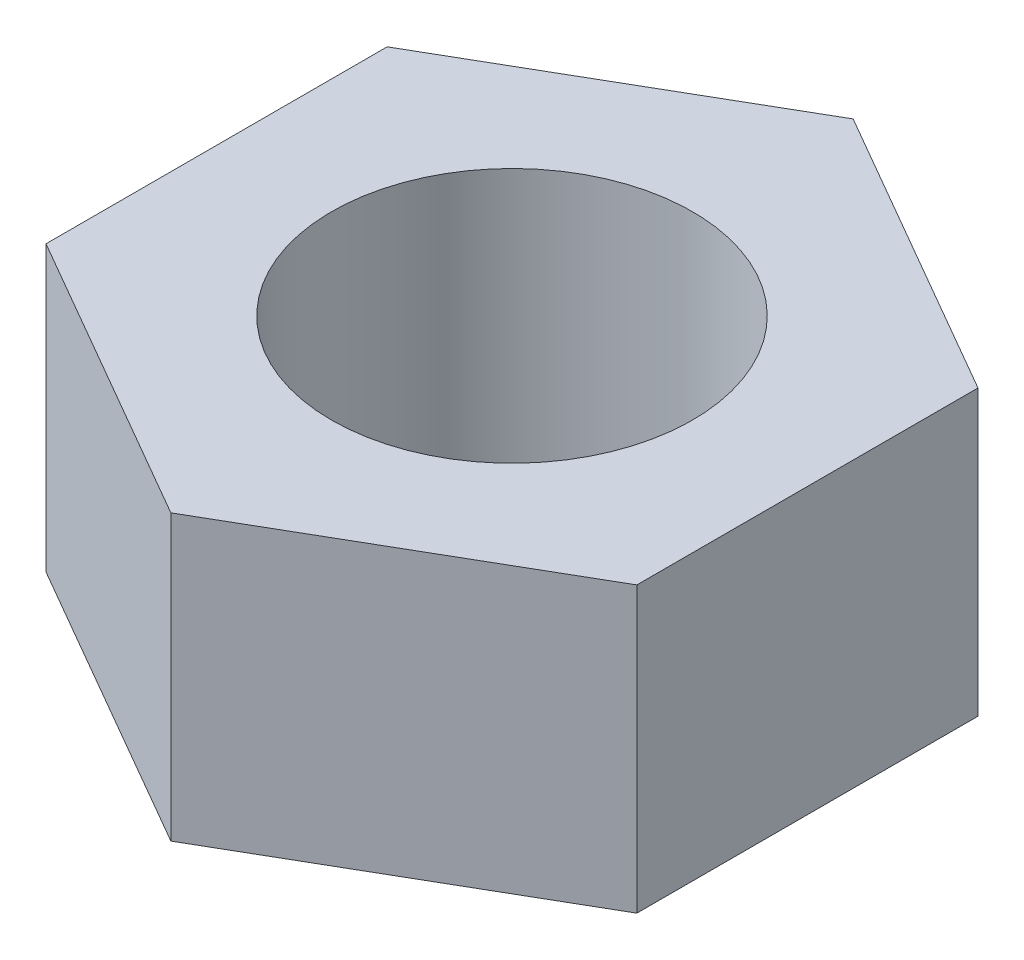
from build123d import *

# Parameters (mm, degrees)
SKETCH1_R           = 3.175
BOSS_EXTRUDE1_DEPTH = 5


with BuildPart() as part:
    # Sketch1 → Boss-Extrude1 (new body)
    with BuildSketch(Plane(origin=(0, 0, 0), x_dir=(1, 0, 0), z_dir=(0, 1, 0))):
        Polygon((0, 6), (-5.196152423, 3), (-5.196152423, -3), (0, -6), (5.196152423, -3), (5.196152423, 3), align=None)
        with Locations(Location((0, 0, 0), (0, 0, 270))):
            Circle(SKETCH1_R, mode=Mode.SUBTRACT)
    extrude(amount=BOSS_EXTRUDE1_DEPTH)


solid = part.part
